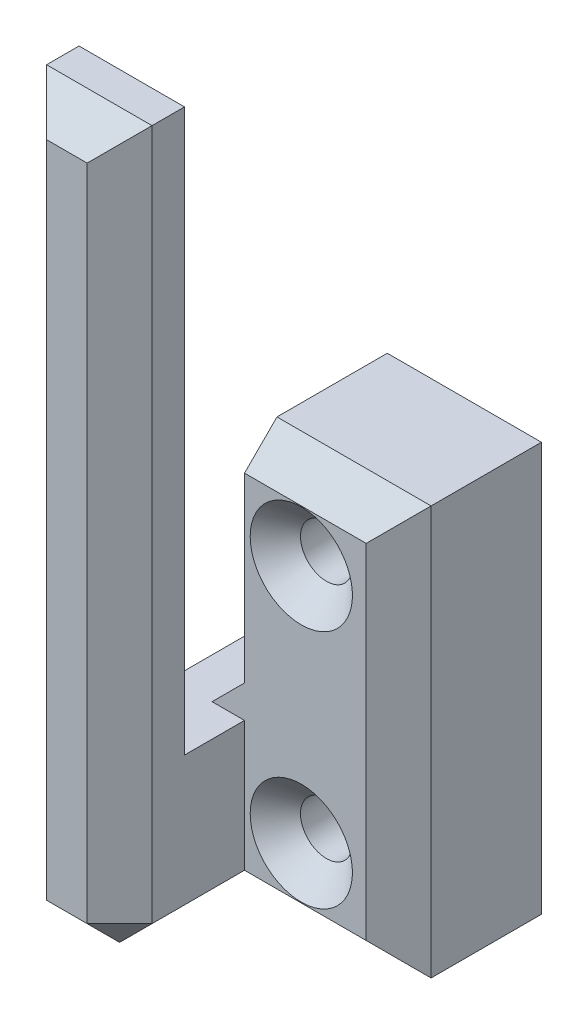
from build123d import *

# Parameters (mm, degrees)
SKETCH1_R                       = 1.6
BOSS_EXTRUDE1_DEPTH             = 8.8
SKETCH2_W                       = 6.5
SKETCH2_H                       = 10
BOSS_EXTRUDE2_DEPTH             = 3.7
BOSS_EXTRUDE2_DIRECTION_2_REACH = 30.332
SKETCH3_W                       = 6.5
SKETCH3_H                       = 44.6
BOSS_EXTRUDE3_DEPTH             = 4
SKETCH4_W                       = 6.5
SKETCH4_H                       = 44.6
CUT_EXTRUDE1_DEPTH              = 51.173797943
CHAMFER2_SIZE                   = 2
CHAMFER3_SIZE                   = 1.55


with BuildPart() as part:
    # Sketch1 → Boss-Extrude1 (new body)
    with BuildSketch(Plane.XY):
        Polygon((0, 0), (8, 0), (9.5, 0), (9.5, 25.2), (8, 25.2), (0, 25.2), align=None)
        with Locations((3.5, 20)):
            Circle(SKETCH1_R, mode=Mode.SUBTRACT)
        with Locations(Location((3.5, 5.2, 0), (0, 0, 180))):
            Circle(SKETCH1_R, mode=Mode.SUBTRACT)
    extrude(amount=BOSS_EXTRUDE1_DEPTH)

    # Sketch2 → Boss-Extrude2 (add)
    with BuildSketch(Plane.XY.offset(8.8)):
        with Locations((12.75, 5)):
            Rectangle(SKETCH2_W, SKETCH2_H)
    boss_extrude2 = extrude(amount=BOSS_EXTRUDE2_DEPTH)

    # Boss-Extrude2 direction 2: up to this face of the body (flat: up to its plane)
    boss_extrude2_direction_2_end = Plane(part.part.faces().sort_by_distance((4.840035102, 12.6, 0))[0])
    # Sketch2 → Boss-Extrude2 direction 2 (add, up to the picked face)
    with BuildSketch(Plane.XY.offset(8.8), mode=Mode.PRIVATE) as boss_extrude2_direction_2_sk1:
        with Locations((12.75, 5)):
            Rectangle(SKETCH2_W, SKETCH2_H)
    boss_extrude2_direction_2_tool1 = split(extrude(boss_extrude2_direction_2_sk1.sketch, amount=-BOSS_EXTRUDE2_DIRECTION_2_REACH, mode=Mode.PRIVATE), bisect_by=boss_extrude2_direction_2_end, keep=Keep.BOTH, mode=Mode.PRIVATE)
    boss_extrude2_direction_2 = boss_extrude2_direction_2_tool1.solids().sort_by(Axis((12.75, 5, 8.8), (0, 0, -1)))[0]
    add(boss_extrude2_direction_2)

    # Sketch3 → Boss-Extrude3 (add)
    with BuildSketch(Plane.XY.offset(12.5)):
        with Locations((12.75, 22.3)):
            Rectangle(SKETCH3_W, SKETCH3_H)
    boss_extrude3 = extrude(amount=BOSS_EXTRUDE3_DEPTH)

    # Mirror1: Boss-Extrude2, Boss-Extrude2 direction 2, Boss-Extrude3 across plane
    add(boss_extrude2.mirror(Plane(origin=(4.75, 0, 0), x_dir=(0, 0, 1), z_dir=(1, 0, 0))))
    add(boss_extrude2_direction_2.mirror(Plane(origin=(4.75, 0, 0), x_dir=(0, 0, 1), z_dir=(1, 0, 0))))
    add(boss_extrude3.mirror(Plane(origin=(4.75, 0, 0), x_dir=(0, 0, 1), z_dir=(1, 0, 0))))

    # Sketch4 → Cut-Extrude1 (cut, through all)
    with BuildSketch(Plane.XY.offset(16.5)):
        with Locations((12.75, 22.3)):
            Rectangle(SKETCH4_W, SKETCH4_H)
    extrude(amount=-CUT_EXTRUDE1_DEPTH, mode=Mode.SUBTRACT)

    # Chamfer2
    chamfer2_edges = [part.edges().sort_by_distance(p)[0] for p in [
        (9.5, 12.6, 8.8),
        (4.75, 25.2, 8.8),
        (0, 10, 4.4),
        (0, 0, 12.65),
        (-6.5, 0, 8.25),
        (-6.5, 10, 6.25),
        (0, 22.3, 16.5),
        (-3.25, 44.6, 16.5),
        (-6.5, 22.3, 16.5),
        (-3.25, 0, 16.5),
        (4.75, 0, 8.8),
    ]]
    chamfer(chamfer2_edges, length=CHAMFER2_SIZE)

    # Chamfer3
    chamfer3_edges = [part.edges().sort_by_distance(p)[0] for p in [
        (1.9, 20, 8.8),
        (5.1, 5.2, 8.8),
    ]]
    chamfer(chamfer3_edges, length=CHAMFER3_SIZE)


solid = part.part
